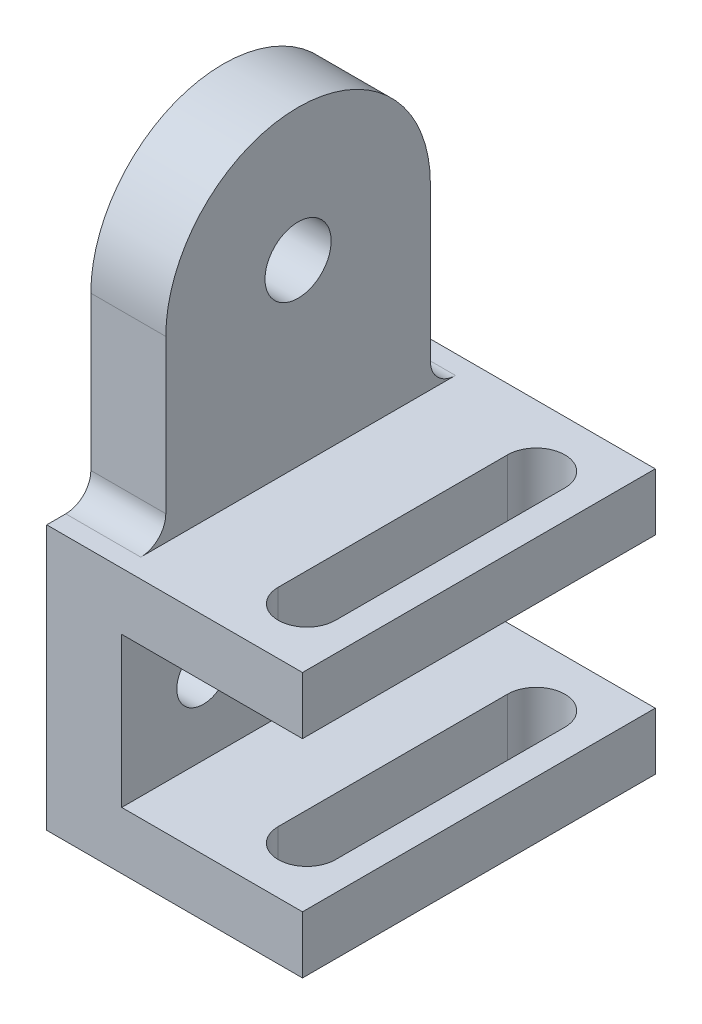
from build123d import *

# Parameters (mm, degrees)
BOSS_EXTRUDE1_DEPTH = 80
BOSS_EXTRUDE2_DEPTH = 17
SKETCH3_R           = 7.5
CUT_EXTRUDE1_DEPTH  = 17
CUT_EXTRUDE2_DEPTH  = 70
SKETCH6_R           = 6
CUT_EXTRUDE3_DEPTH  = 20


with BuildPart() as part:
    # Sketch1 → Boss-Extrude1 (new body)
    with BuildSketch(Plane.XY):
        Polygon((-12, 17), (-12, -17), (29, -17), (29, -30), (-29, -30), (-29, 30), (29, 30), (29, 17), align=None)
    extrude(amount=-BOSS_EXTRUDE1_DEPTH)

    # Sketch2 → Boss-Extrude2 (add)
    with BuildSketch(Plane.ZY.offset(29)):
        with BuildLine():
            Line((-70, 70.5), (-70, 35.68393157))
            ThreePointArc((-70, 35.68393157), (-71.664785013, 31.664785013), (-75.68393157, 30))
            Line((-75.68393157, 30), (-4.31606843, 30))
            ThreePointArc((-4.31606843, 30), (-8.335214987, 31.664785013), (-10, 35.68393157))
            Line((-10, 35.68393157), (-10, 70.5))
            ThreePointArc((-10, 70.5), (-40, 100.5), (-70, 70.5))
        make_face()
    extrude(amount=-BOSS_EXTRUDE2_DEPTH)

    # Sketch3 → Cut-Extrude1 (cut)
    with BuildSketch(Plane.ZY.offset(29)):
        with Locations(Location((-40, 70.5, 0), (0, 0, 270))):
            Circle(SKETCH3_R)
    extrude(amount=-CUT_EXTRUDE1_DEPTH, mode=Mode.SUBTRACT)

    # Sketch4 → Cut-Extrude2 (cut)
    with BuildSketch(Plane(origin=(0, 30, 0), x_dir=(1, 0, 0), z_dir=(0, 1, 0))):
        with BuildLine():
            Line((9.5, 66), (9.5, 14))
            ThreePointArc((9.5, 14), (16, 7.5), (22.5, 14))
            Line((22.5, 14), (22.5, 66))
            ThreePointArc((22.5, 66), (16, 72.5), (9.5, 66))
        make_face()
    extrude(amount=-CUT_EXTRUDE2_DEPTH, mode=Mode.SUBTRACT)

    # Sketch6 → Cut-Extrude3 (cut)
    with BuildSketch(Plane(origin=(-12, 0, 0), x_dir=(0, 0, -1), z_dir=(1, 0, 0))):
        with Locations(Location((18.5, 0, 0), (0, 0, 90))):
            Circle(SKETCH6_R)
        with Locations(Location((61.5, 0, 0), (0, 0, 90))):
            Circle(SKETCH6_R)
    extrude(amount=-CUT_EXTRUDE3_DEPTH, mode=Mode.SUBTRACT)


solid = part.part
